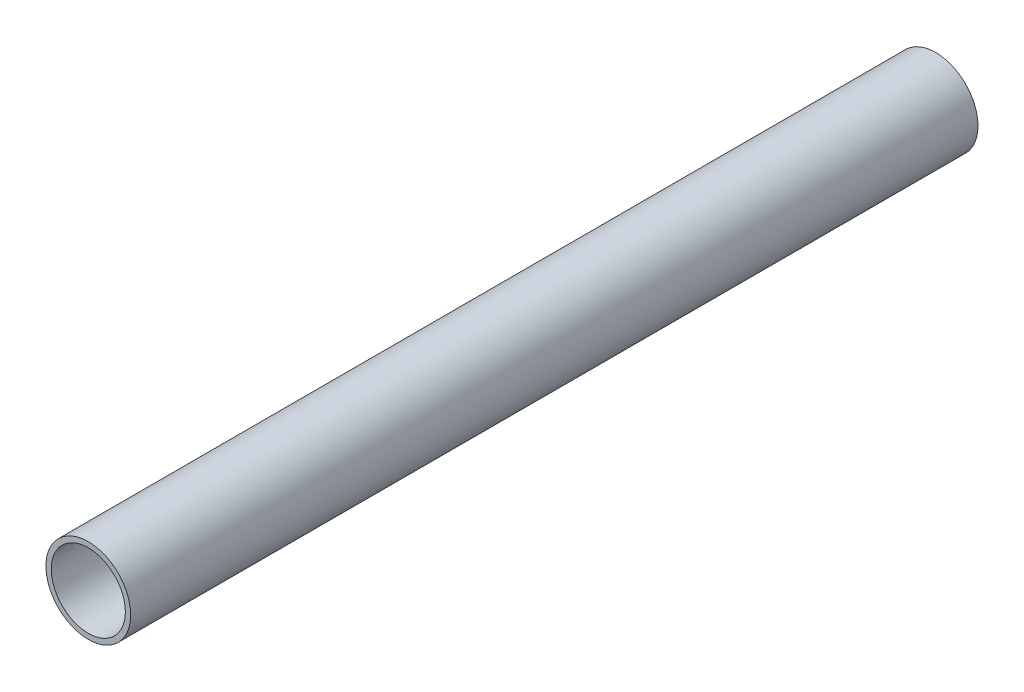
from build123d import *

# Parameters (mm, degrees)
SKETCH1_R           = 8
SKETCH1_R_2         = 7
BOSS_EXTRUDE1_DEPTH = 160


with BuildPart() as part:
    # Sketch1 → Boss-Extrude1 (new body)
    with BuildSketch(Plane.XY):
        Circle(SKETCH1_R)
        Circle(SKETCH1_R_2, mode=Mode.SUBTRACT)
    extrude(amount=BOSS_EXTRUDE1_DEPTH)


solid = part.part
